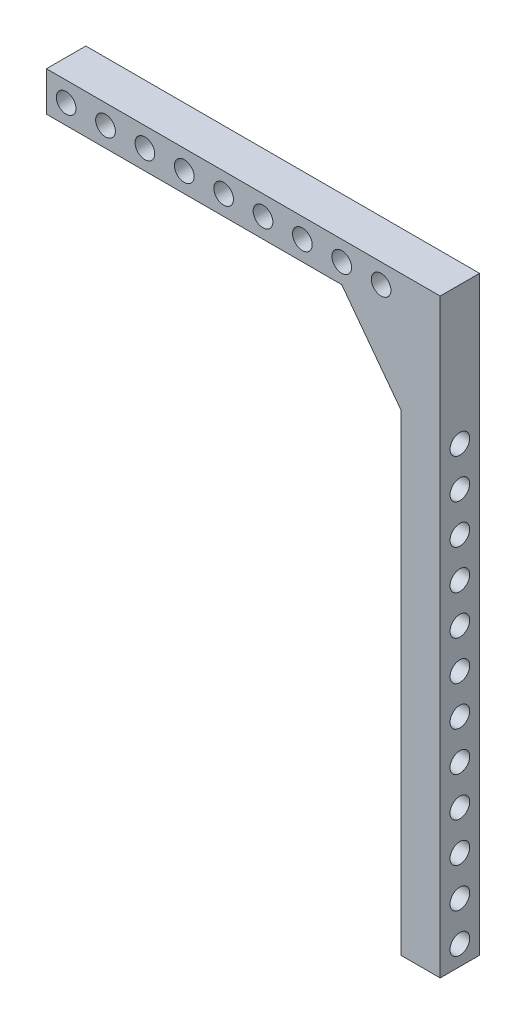
from build123d import *

# Parameters (mm, degrees)
ESQUISSE2_W             = 10
ESQUISSE2_H             = 10
BOSS_EXTRU_1_DEPTH      = 90
ESQUISSE3_W             = 10
ESQUISSE3_H             = 150
ESQUISSE3_R             = 2.5
BOSS_EXTRU_2_DEPTH      = 10
ESQUISSE4_R             = 2.5
ENL_V_MAT_EXTRU_1_DEPTH = 10
BOSS_EXTRU_3_DEPTH      = 10


with BuildPart() as part:
    # Esquisse2 → Boss.-Extru.1 (new body)
    with BuildSketch(Plane(origin=(0, 0, 0), x_dir=(0, 0, -1), z_dir=(1, 0, 0))):
        Rectangle(ESQUISSE2_W, ESQUISSE2_H)
    extrude(amount=BOSS_EXTRU_1_DEPTH)

    # Esquisse3 → Boss.-Extru.2 (add)
    with BuildSketch(Plane(origin=(90, 0, 0), x_dir=(0, 0, -1), z_dir=(1, 0, 0))):
        with Locations((0, -70)):
            Rectangle(ESQUISSE3_W, ESQUISSE3_H)
        with Locations((0, -140)):
            Circle(ESQUISSE3_R, mode=Mode.SUBTRACT)
        with Locations((0, -130)):
            Circle(ESQUISSE3_R, mode=Mode.SUBTRACT)
        with Locations((0, -120)):
            Circle(ESQUISSE3_R, mode=Mode.SUBTRACT)
        with Locations((0, -110)):
            Circle(ESQUISSE3_R, mode=Mode.SUBTRACT)
        with Locations((0, -100)):
            Circle(ESQUISSE3_R, mode=Mode.SUBTRACT)
        with Locations((0, -90)):
            Circle(ESQUISSE3_R, mode=Mode.SUBTRACT)
        with Locations((0, -80)):
            Circle(ESQUISSE3_R, mode=Mode.SUBTRACT)
        with Locations((0, -70)):
            Circle(ESQUISSE3_R, mode=Mode.SUBTRACT)
        with Locations((0, -60)):
            Circle(ESQUISSE3_R, mode=Mode.SUBTRACT)
        with Locations((0, -50)):
            Circle(ESQUISSE3_R, mode=Mode.SUBTRACT)
        with Locations((0, -40)):
            Circle(ESQUISSE3_R, mode=Mode.SUBTRACT)
        with Locations((0, -30)):
            Circle(ESQUISSE3_R, mode=Mode.SUBTRACT)
    extrude(amount=BOSS_EXTRU_2_DEPTH)

    # Esquisse4 → Enlèv. mat.-Extru.1 (cut)
    with BuildSketch(Plane(origin=(0, 0, -5), x_dir=(-1, 0, 0), z_dir=(0, 0, -1))):
        with Locations((-5, 0)):
            Circle(ESQUISSE4_R)
        with Locations((-15, 0)):
            Circle(ESQUISSE4_R)
        with Locations((-25, 0)):
            Circle(ESQUISSE4_R)
        with Locations((-35, 0)):
            Circle(ESQUISSE4_R)
        with Locations((-45, 0)):
            Circle(ESQUISSE4_R)
        with Locations((-55, 0)):
            Circle(ESQUISSE4_R)
        with Locations((-65, 0)):
            Circle(ESQUISSE4_R)
        with Locations((-75, 0)):
            Circle(ESQUISSE4_R)
        with Locations((-85, 0)):
            Circle(ESQUISSE4_R)
    extrude(amount=-ENL_V_MAT_EXTRU_1_DEPTH, mode=Mode.SUBTRACT)

    # Esquisse5 → Boss.-Extru.3 (add)
    with BuildSketch(Plane(origin=(0, 0, -5), x_dir=(-1, 0, 0), z_dir=(0, 0, -1))):
        Polygon((-75, -5), (-90, -25), (-90, -5), align=None)
    extrude(amount=-BOSS_EXTRU_3_DEPTH)


solid = part.part
